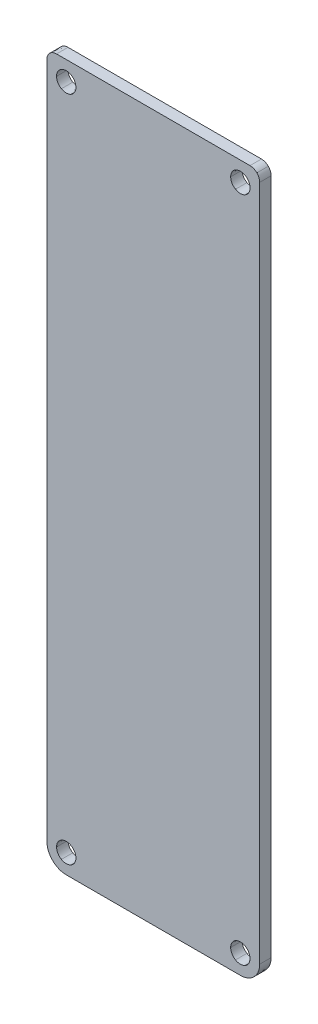
from build123d import *

# Parameters (mm, degrees)
BOSS_EXTRU_1_DEPTH = 1.5


with BuildPart() as part:
    # Model → Boss.-Extru.1 (new body)
    with BuildSketch(Plane.XY):
        with BuildLine():
            Line((110.49, -34.813931), (110.49, -38.623931))
            Line((110.49, -38.623931), (110.49, -39.893931))
            Line((110.49, -39.893931), (110.49, -123.713931))
            add(Edge.make_bspline(
                [(109.746051, -125.509982), (110.222394, -125.03364), (110.49, -124.387581), (110.49, -123.713931)],
                knots=[0, 0, 0, 0, 1, 1, 1, 1], degree=3))
            add(Edge.make_bspline(
                [(107.95, -126.253931), (108.62365, -126.253931), (109.269709, -125.986325), (109.746051, -125.509982)],
                knots=[0, 0, 0, 0, 1, 1, 1, 1], degree=3))
            Line((107.95, -126.253931), (85.09, -126.253931))
            add(Edge.make_bspline(
                [(83.293949, -125.509982), (83.770291, -125.986325), (84.41635, -126.253931), (85.09, -126.253931)],
                knots=[0, 0, 0, 0, 1, 1, 1, 1], degree=3))
            add(Edge.make_bspline(
                [(82.55, -123.713931), (82.55, -124.387581), (82.817606, -125.03364), (83.293949, -125.509982)],
                knots=[0, 0, 0, 0, 1, 1, 1, 1], degree=3))
            Line((82.55, -123.713931), (82.55, -39.893931))
            Line((82.55, -39.893931), (82.55, -38.623931))
            Line((82.55, -38.623931), (82.55, -34.813931))
            add(Edge.make_bspline(
                [(82.921974, -33.915905), (82.683803, -34.154076), (82.55, -34.477106), (82.55, -34.813931)],
                knots=[0, 0, 0, 0, 1, 1, 1, 1], degree=3))
            add(Edge.make_bspline(
                [(83.82, -33.543931), (83.483175, -33.543931), (83.160146, -33.677734), (82.921974, -33.915905)],
                knots=[0, 0, 0, 0, 1, 1, 1, 1], degree=3))
            Line((83.82, -33.543931), (109.22, -33.543931))
            add(Edge.make_bspline(
                [(110.118026, -33.915905), (109.879854, -33.677734), (109.556825, -33.543931), (109.22, -33.543931)],
                knots=[0, 0, 0, 0, 1, 1, 1, 1], degree=3))
            add(Edge.make_bspline(
                [(110.49, -34.813931), (110.49, -34.477106), (110.356197, -34.154076), (110.118026, -33.915905)],
                knots=[0, 0, 0, 0, 1, 1, 1, 1], degree=3))
        make_face()
        with BuildLine():
            add(Edge.make_bspline(
                [(109.22, -36.083931), (109.22, -36.537658), (108.977939, -36.956919), (108.585, -37.183783)],
                knots=[0, 0, 0, 0, 1, 1, 1, 1], degree=3))
            add(Edge.make_bspline(
                [(108.585, -37.183783), (108.192061, -37.410647), (107.707939, -37.410647), (107.315, -37.183783)],
                knots=[0, 0, 0, 0, 1, 1, 1, 1], degree=3))
            add(Edge.make_bspline(
                [(107.315, -37.183783), (106.922061, -36.956919), (106.68, -36.537658), (106.68, -36.083931)],
                knots=[0, 0, 0, 0, 1, 1, 1, 1], degree=3))
            add(Edge.make_bspline(
                [(106.68, -36.083931), (106.68, -35.630204), (106.922061, -35.210942), (107.315, -34.984079)],
                knots=[0, 0, 0, 0, 1, 1, 1, 1], degree=3))
            add(Edge.make_bspline(
                [(107.315, -34.984079), (107.707939, -34.757215), (108.192061, -34.757215), (108.585, -34.984079)],
                knots=[0, 0, 0, 0, 1, 1, 1, 1], degree=3))
            add(Edge.make_bspline(
                [(108.585, -34.984079), (108.977939, -35.210942), (109.22, -35.630204), (109.22, -36.083931)],
                knots=[0, 0, 0, 0, 1, 1, 1, 1], degree=3))
        make_face(mode=Mode.SUBTRACT)
        with BuildLine():
            add(Edge.make_bspline(
                [(86.36, -36.083931), (86.36, -36.537658), (86.117939, -36.956919), (85.725, -37.183783)],
                knots=[0, 0, 0, 0, 1, 1, 1, 1], degree=3))
            add(Edge.make_bspline(
                [(85.725, -37.183783), (85.332061, -37.410647), (84.847939, -37.410647), (84.455, -37.183783)],
                knots=[0, 0, 0, 0, 1, 1, 1, 1], degree=3))
            add(Edge.make_bspline(
                [(84.455, -37.183783), (84.062061, -36.956919), (83.82, -36.537658), (83.82, -36.083931)],
                knots=[0, 0, 0, 0, 1, 1, 1, 1], degree=3))
            add(Edge.make_bspline(
                [(83.82, -36.083931), (83.82, -35.630204), (84.062061, -35.210942), (84.455, -34.984079)],
                knots=[0, 0, 0, 0, 1, 1, 1, 1], degree=3))
            add(Edge.make_bspline(
                [(84.455, -34.984079), (84.847939, -34.757215), (85.332061, -34.757215), (85.725, -34.984079)],
                knots=[0, 0, 0, 0, 1, 1, 1, 1], degree=3))
            add(Edge.make_bspline(
                [(85.725, -34.984079), (86.117939, -35.210942), (86.36, -35.630204), (86.36, -36.083931)],
                knots=[0, 0, 0, 0, 1, 1, 1, 1], degree=3))
        make_face(mode=Mode.SUBTRACT)
        with BuildLine():
            add(Edge.make_bspline(
                [(86.36, -123.713931), (86.36, -124.167658), (86.117939, -124.586919), (85.725, -124.813783)],
                knots=[0, 0, 0, 0, 1, 1, 1, 1], degree=3))
            add(Edge.make_bspline(
                [(85.725, -124.813783), (85.332061, -125.040647), (84.847939, -125.040647), (84.455, -124.813783)],
                knots=[0, 0, 0, 0, 1, 1, 1, 1], degree=3))
            add(Edge.make_bspline(
                [(84.455, -124.813783), (84.062061, -124.586919), (83.82, -124.167658), (83.82, -123.713931)],
                knots=[0, 0, 0, 0, 1, 1, 1, 1], degree=3))
            add(Edge.make_bspline(
                [(83.82, -123.713931), (83.82, -123.260204), (84.062061, -122.840942), (84.455, -122.614079)],
                knots=[0, 0, 0, 0, 1, 1, 1, 1], degree=3))
            add(Edge.make_bspline(
                [(84.455, -122.614079), (84.847939, -122.387215), (85.332061, -122.387215), (85.725, -122.614079)],
                knots=[0, 0, 0, 0, 1, 1, 1, 1], degree=3))
            add(Edge.make_bspline(
                [(85.725, -122.614079), (86.117939, -122.840942), (86.36, -123.260204), (86.36, -123.713931)],
                knots=[0, 0, 0, 0, 1, 1, 1, 1], degree=3))
        make_face(mode=Mode.SUBTRACT)
        with BuildLine():
            add(Edge.make_bspline(
                [(109.22, -123.713931), (109.22, -124.167658), (108.977939, -124.586919), (108.585, -124.813783)],
                knots=[0, 0, 0, 0, 1, 1, 1, 1], degree=3))
            add(Edge.make_bspline(
                [(108.585, -124.813783), (108.192061, -125.040647), (107.707939, -125.040647), (107.315, -124.813783)],
                knots=[0, 0, 0, 0, 1, 1, 1, 1], degree=3))
            add(Edge.make_bspline(
                [(107.315, -124.813783), (106.922061, -124.586919), (106.68, -124.167658), (106.68, -123.713931)],
                knots=[0, 0, 0, 0, 1, 1, 1, 1], degree=3))
            add(Edge.make_bspline(
                [(106.68, -123.713931), (106.68, -123.260204), (106.922061, -122.840942), (107.315, -122.614079)],
                knots=[0, 0, 0, 0, 1, 1, 1, 1], degree=3))
            add(Edge.make_bspline(
                [(107.315, -122.614079), (107.707939, -122.387215), (108.192061, -122.387215), (108.585, -122.614079)],
                knots=[0, 0, 0, 0, 1, 1, 1, 1], degree=3))
            add(Edge.make_bspline(
                [(108.585, -122.614079), (108.977939, -122.840942), (109.22, -123.260204), (109.22, -123.713931)],
                knots=[0, 0, 0, 0, 1, 1, 1, 1], degree=3))
        make_face(mode=Mode.SUBTRACT)
    extrude(amount=BOSS_EXTRU_1_DEPTH)


solid = part.part
